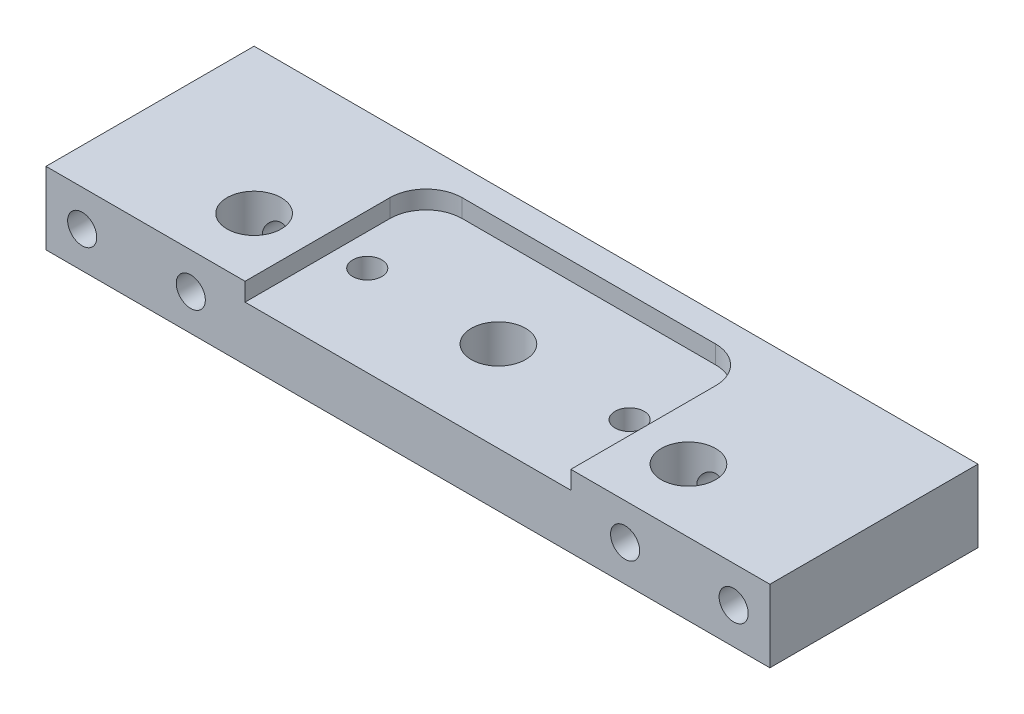
from build123d import *

# Parameters (mm, degrees)
SKETCH1_W                         = 127
SKETCH1_H                         = 50.8
BOSS_EXTRUDE1_DEPTH               = 6.35
TAPPED_HOLE_FOR_10_32_HELICOIL1_D = 5.1054
SKETCH7_W                         = 127
SKETCH7_H                         = 14.2875
CUT_EXTRUDE2_DEPTH                = 70.560764803
TAPPED_HOLE_FOR_10_32_HELICOIL3_D = 5.1054
SKETCH4_R                         = 4.7625
CUT_EXTRUDE1_DEPTH                = 70.560764803
CUT_EXTRUDE4_DEPTH                = 3.175
F_10_CLEARANCE_HOLE3_D            = 5.1054
F_10_CLEARANCE_HOLE3_DEPTH        = 12.7
F_10_CLEARANCE_HOLE3_TIP          = 1.533816902


with BuildPart() as part:
    # Sketch1 → Boss-Extrude1 (new, symmetric)
    with BuildSketch(Plane(origin=(0, 0, 0), x_dir=(1, 0, 0), z_dir=(0, 1, 0))):
        Rectangle(SKETCH1_W, SKETCH1_H)
    extrude(amount=BOSS_EXTRUDE1_DEPTH, both=True)

    # Tapped Hole for #10-32 Helicoil1 (through all)
    with Locations(Plane(origin=(0, 0, -25.4), x_dir=(-1, 0, 0), z_dir=(0, 0, -1))):
        with Locations((-57.15, 0), (57.15, 0)):
            Hole(TAPPED_HOLE_FOR_10_32_HELICOIL1_D / 2)

    # Sketch7 → Cut-Extrude2 (cut, through all)
    with BuildSketch(Plane(origin=(0, 6.35, 0), x_dir=(1, 0, 0), z_dir=(0, 1, 0))):
        with Locations((0, -18.25625)):
            Rectangle(SKETCH7_W, SKETCH7_H)
    extrude(amount=-CUT_EXTRUDE2_DEPTH, mode=Mode.SUBTRACT)

    # Tapped Hole for #10-32 Helicoil3 (through all)
    with Locations(Plane.XY.offset(11.1125)):
        with Locations((-38.1, 0), (38.1, 0)):
            Hole(TAPPED_HOLE_FOR_10_32_HELICOIL3_D / 2)

    # Sketch4 → Cut-Extrude1 (cut, through all)
    with BuildSketch(Plane(origin=(0, 6.35, 0), x_dir=(1, 0, 0), z_dir=(0, 1, 0))):
        with Locations(Location((-38.1, 0, 0), (0, 0, 270))):
            Circle(SKETCH4_R)
        with Locations(Location((38.1, 0, 0), (0, 0, 270))):
            Circle(SKETCH4_R)
        with Locations(Location((0, 4.7625, 0), (0, 0, 270))):
            Circle(SKETCH4_R)
    extrude(amount=-CUT_EXTRUDE1_DEPTH, mode=Mode.SUBTRACT)

    # Sketch11 → Cut-Extrude4 (cut)
    with BuildSketch(Plane(origin=(0, 6.35, 0), x_dir=(1, 0, 0), z_dir=(0, 1, 0))):
        with BuildLine():
            Line((-22.225, 20.6375), (22.225, 20.6375))
            ThreePointArc((22.225, 20.6375), (26.715128061, 18.777628061), (28.575, 14.2875))
            Line((28.575, 14.2875), (28.575, -11.1125))
            Line((28.575, -11.1125), (-28.575, -11.1125))
            Line((-28.575, -11.1125), (-28.575, 14.2875))
            ThreePointArc((-28.575, 14.2875), (-26.715128061, 18.777628061), (-22.225, 20.6375))
        make_face()
    extrude(amount=-CUT_EXTRUDE4_DEPTH, mode=Mode.SUBTRACT)

    # #10 Clearance Hole3
    with Locations(Plane(origin=(0, 3.175, 0), x_dir=(1, 0, 0), z_dir=(0, 1, 0))):
        with Locations((-23.0124, 4.7625), (23.0124, 4.7625)):
            Hole(F_10_CLEARANCE_HOLE3_D / 2, depth=F_10_CLEARANCE_HOLE3_DEPTH)
            with Locations((0, 0, -(F_10_CLEARANCE_HOLE3_DEPTH + F_10_CLEARANCE_HOLE3_TIP / 2))):  # 118° drill point
                Cone(0, F_10_CLEARANCE_HOLE3_D / 2, F_10_CLEARANCE_HOLE3_TIP, mode=Mode.SUBTRACT)


solid = part.part
